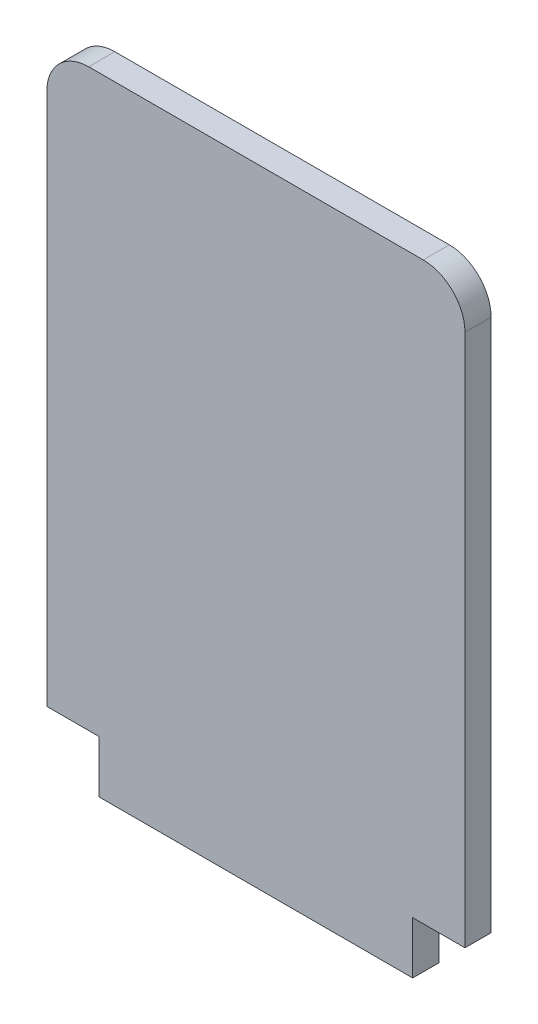
from build123d import *

# Parameters (mm, degrees)
BOSS_EXTRUDE1_DEPTH = 6.35
FILLET1_R           = 10.16


with BuildPart() as part:
    # Sketch1 → Boss-Extrude1 (new body)
    with BuildSketch(Plane.XY):
        Polygon((88.9, 0), (101.6, 0), (101.6, 139.7), (0, 139.7), (0, 0), (12.7, 0), (12.7, -12.7), (88.9, -12.7), align=None)
    extrude(amount=BOSS_EXTRUDE1_DEPTH)

    # Fillet1
    fillet1_edges = [part.edges().sort_by_distance(p)[0] for p in [
        (0, 139.7, 3.175),
        (101.6, 139.7, 3.175),
    ]]
    fillet(fillet1_edges, radius=FILLET1_R)


solid = part.part
